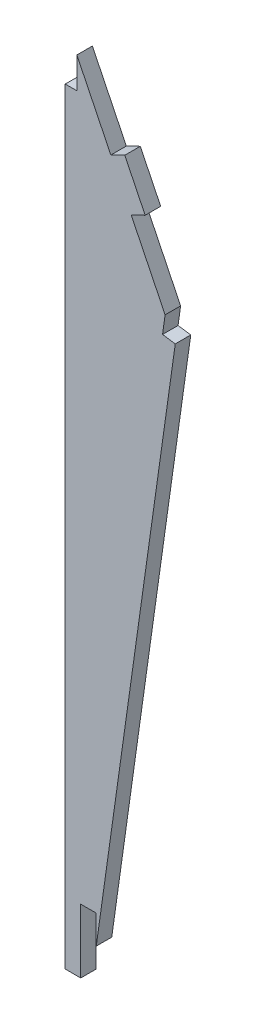
from build123d import *

# Parameters (mm, degrees)
EXTRUDE_1_DEPTH = 2


with BuildPart() as part:
    # 草图1 → 凸台-拉伸1 (new body)
    with BuildSketch(Plane.XY):
        Polygon((11.11212578, 105.701557558), (11.11212578, 101.701557558), (9.61212578, 101.701557558), (9.61212578, 2.831603437), (11.61212578, 2.831603437), (11.61212578, 11.081603437), (13.61212578, 11.081603437), (13.61212578, 7.390728471), (23.805965972, 79.771096389), (22.164415993, 80.002287507), (22.496490576, 82.360150685), (18.126064129, 91.320852817), (19.923652222, 92.197595111), (17.293425341, 97.590359388), (15.495837248, 96.713617095), align=None)
    extrude(amount=EXTRUDE_1_DEPTH)


solid = part.part
